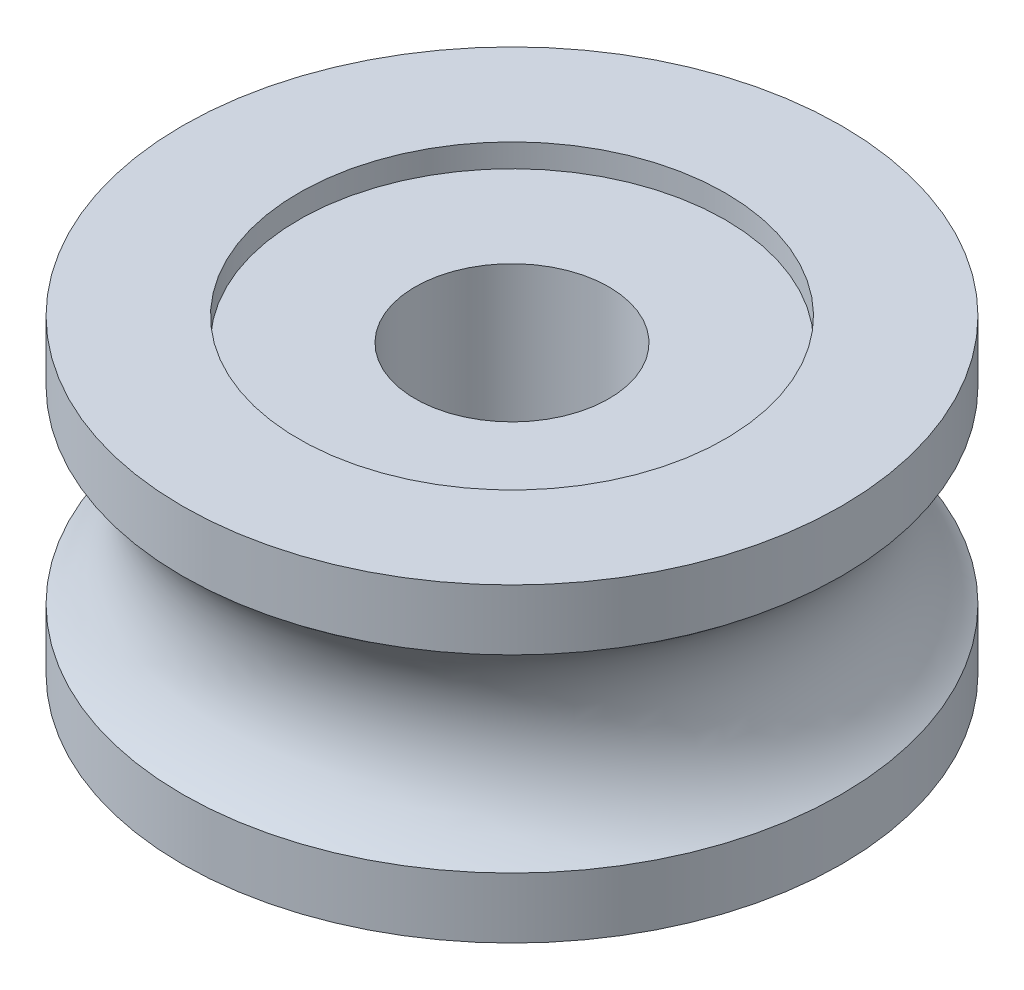
from build123d import *


with BuildPart() as part:
    # Эскиз1 → Повернуть1 (revolve)
    with BuildSketch(Plane.XY, mode=Mode.PRIVATE) as revolve_1_sk:
        with BuildLine():
            Line((2.5, -4.6), (2.5, 4.6))
            Line((2.5, 4.6), (5.5, 4.6))
            Line((5.5, 4.6), (5.5, 5.2))
            Line((5.5, 5.2), (8.5, 5.2))
            Line((8.5, 5.2), (8.5, 3.636698586))
            ThreePointArc((8.5, 3.636698586), (7.25, 1.2), (8.5, -1.236698586))
            Line((8.5, -1.236698586), (8.5, -2.8))
            Line((8.5, -2.8), (4.3, -2.8))
            Line((4.3, -2.8), (4.3, -4.6))
            Line((4.3, -4.6), (2.5, -4.6))
        make_face()
    revolve(revolve_1_sk.sketch.rotate(Axis((0, 0, 0), (0, 1, 0)), 90), axis=Axis((0, 0, 0), (0, 1, 0)))


solid = part.part
